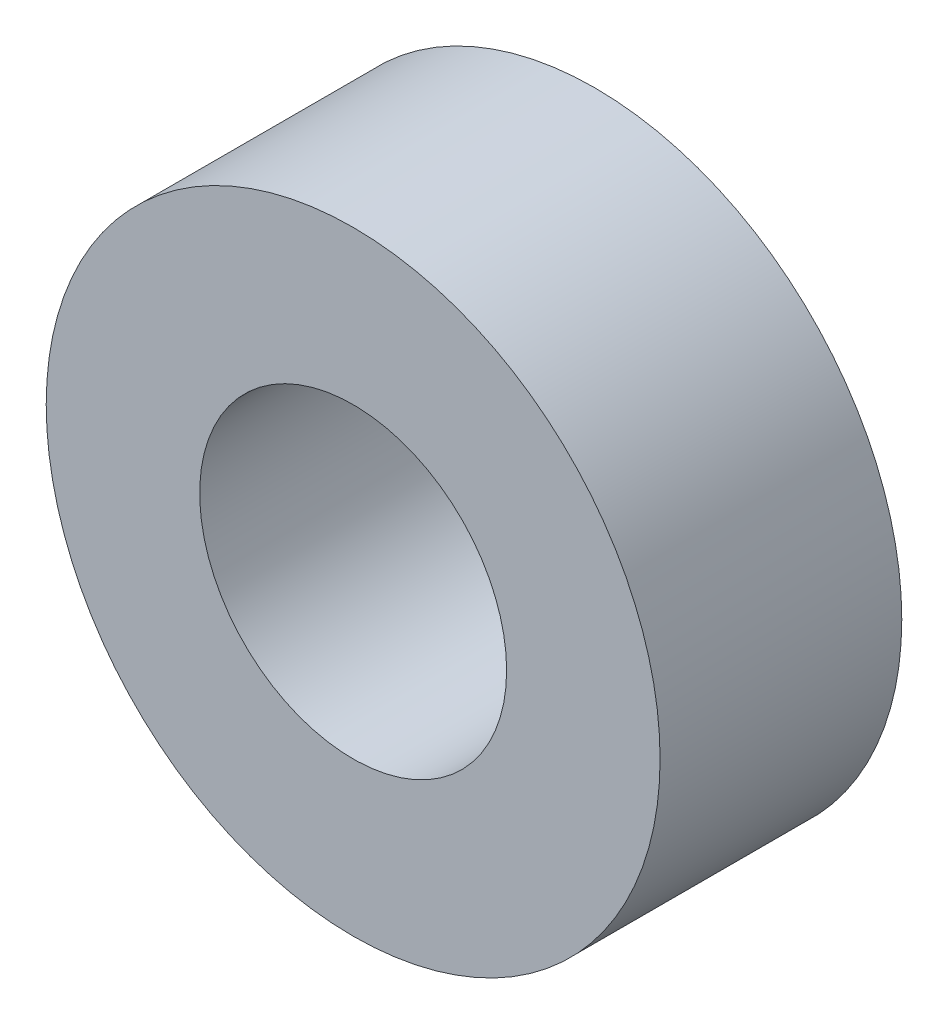
from build123d import *

# Parameters (mm, degrees)
CROQUIS1_R              = 6.35
CROQUIS1_R_2            = 3.175
SALIENTE_EXTRUIR1_DEPTH = 5


with BuildPart() as part:
    # Croquis1 → Saliente-Extruir1 (new body)
    with BuildSketch(Plane.XY):
        Circle(CROQUIS1_R)
        Circle(CROQUIS1_R_2, mode=Mode.SUBTRACT)
    extrude(amount=SALIENTE_EXTRUIR1_DEPTH)


solid = part.part
